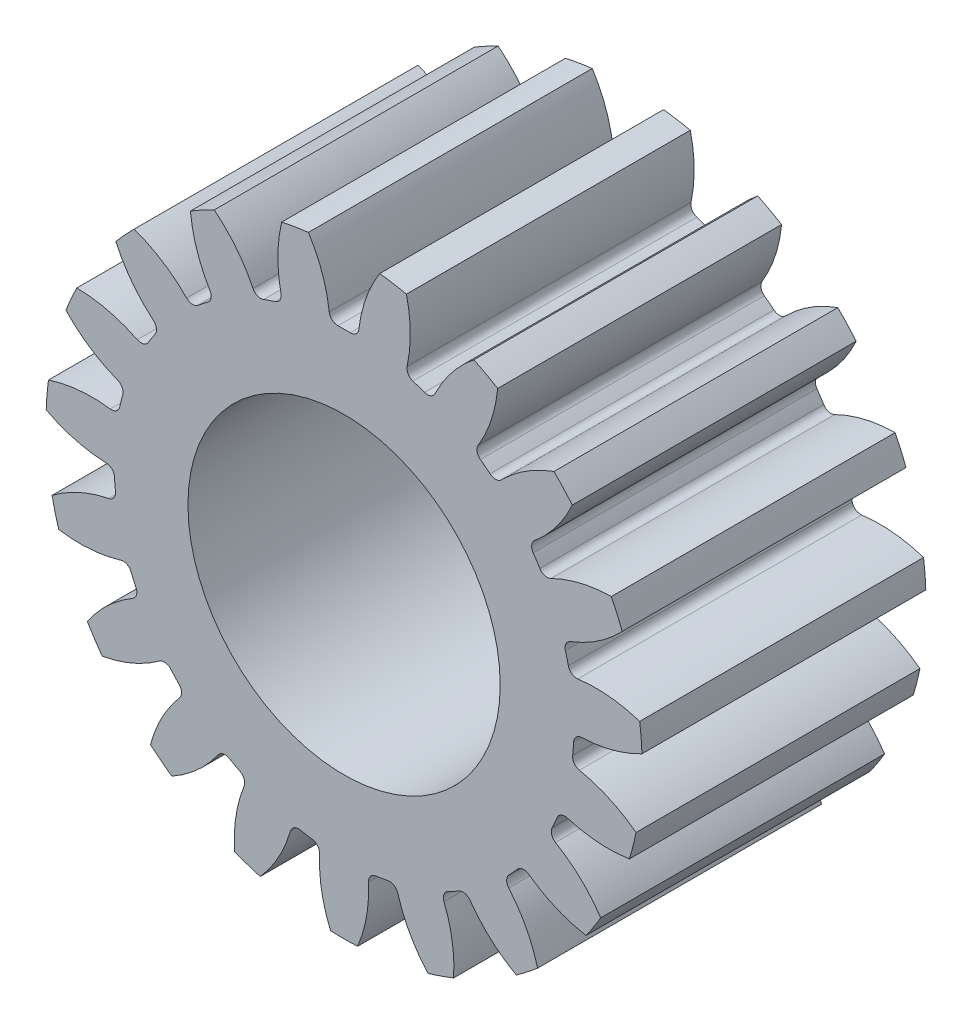
from build123d import *

# Parameters (mm, degrees)
SKETCH2_R                = 10.5
BOSS_EXTRUDE1_DEPTH      = 5
CUT_EXTRUDE1_DEPTH       = 16.668439616
FILLET1_R                = 0.3
CIRPATTERN1_COUNT        = 19
FILLET1_OF_CIRPATTERN1_R = 0.3
SKETCH4_R                = 5.5
CUT_EXTRUDE3_DEPTH       = 10


with BuildPart() as part:
    # Sketch2 → Boss-Extrude1 (new, symmetric)
    with BuildSketch(Plane.XY):
        Circle(SKETCH2_R)
    extrude(amount=BOSS_EXTRUDE1_DEPTH, both=True)

    # Sketch3 → Cut-Extrude1 (cut, symmetric)
    with BuildSketch(Plane.XY):
        with BuildLine():
            ThreePointArc((0.496686286, 8.084757432), (0, 8.1), (-0.496686286, 8.084757432))
            ThreePointArc((-0.496686286, 8.084757432), (-0.727830795, 9.302840706), (-1.255782118, 10.424634827))
            ThreePointArc((-1.255782118, 10.424634827), (0, 10.5), (1.255782118, 10.424634827))
            ThreePointArc((1.255782118, 10.424634827), (0.727830795, 9.302840706), (0.496686286, 8.084757432))
        make_face()
    cut_extrude1 = extrude(amount=CUT_EXTRUDE1_DEPTH, both=True, mode=Mode.SUBTRACT)

    # Fillet1
    fillet1_edges = [part.edges().sort_by_distance(p)[0] for p in [
        (0.496686286, 8.084757432, 0),
        (-0.496686286, 8.084757432, 0),
    ]]
    fillet(fillet1_edges, radius=FILLET1_R)

    # CirPattern1: Cut-Extrude1 ×19 about axis
    cirpattern1_axis = Axis((0, 0, -11), (0, 0, 1))
    for i in range(1, CIRPATTERN1_COUNT):
        add(cut_extrude1.rotate(cirpattern1_axis, i * 360 / CIRPATTERN1_COUNT), mode=Mode.SUBTRACT)

    # Fillet1 of CirPattern1
    fillet1_of_cirpattern1_edges = [part.edges().sort_by_distance(p)[0] for p in [
        (-2.155341994, 7.807976747, 0),
        (-3.094890899, 7.485429201, 0),
        (-4.573805525, 6.685080629, 0),
        (-5.357716062, 6.074938567, 0),
        (-6.496626258, 4.837752295, 0),
        (-7.039949556, 4.006134078, 0),
        (-7.71543673, 2.466178434, 0),
        (-7.959295279, 1.503202799, 0),
        (-8.098159915, -0.172644127, 0),
        (-8.016127858, -1.162623827, 0),
        (-7.603321817, -2.792758018, 0),
        (-7.2042886, -3.702462122, 0),
        (-6.284545823, -5.110233243, 0),
        (-5.611752887, -5.841081196, 0),
        (-4.284741774, -6.873935404, 0),
        (-3.411096672, -7.346728489, 0),
        (-1.820619469, -7.892740003, 0),
        (-0.840795205, -8.056243754, 0),
        (0.840795205, -8.056243754, 0),
        (1.820619469, -7.892740003, 0),
        (3.411096672, -7.346728489, 0),
        (4.284741774, -6.873935404, 0),
        (5.611752887, -5.841081196, 0),
        (6.284545823, -5.110233243, 0),
        (7.2042886, -3.702462122, 0),
        (7.603321817, -2.792758018, 0),
        (8.016127858, -1.162623827, 0),
        (8.098159915, -0.172644127, 0),
        (7.959295279, 1.503202799, 0),
        (7.71543673, 2.466178434, 0),
        (7.039949556, 4.006134078, 0),
        (6.496626258, 4.837752295, 0),
        (5.357716062, 6.074938567, 0),
        (4.573805525, 6.685080629, 0),
        (3.094890899, 7.485429201, 0),
        (2.155341994, 7.807976747, 0),
    ]]
    fillet(fillet1_of_cirpattern1_edges, radius=FILLET1_OF_CIRPATTERN1_R)

    # Sketch4 → Cut-Extrude3 (cut)
    with BuildSketch(Plane(origin=(0, 0, -5), x_dir=(-1, 0, 0), z_dir=(0, 0, -1))):
        Circle(SKETCH4_R)
    extrude(amount=-CUT_EXTRUDE3_DEPTH, mode=Mode.SUBTRACT)


solid = part.part
